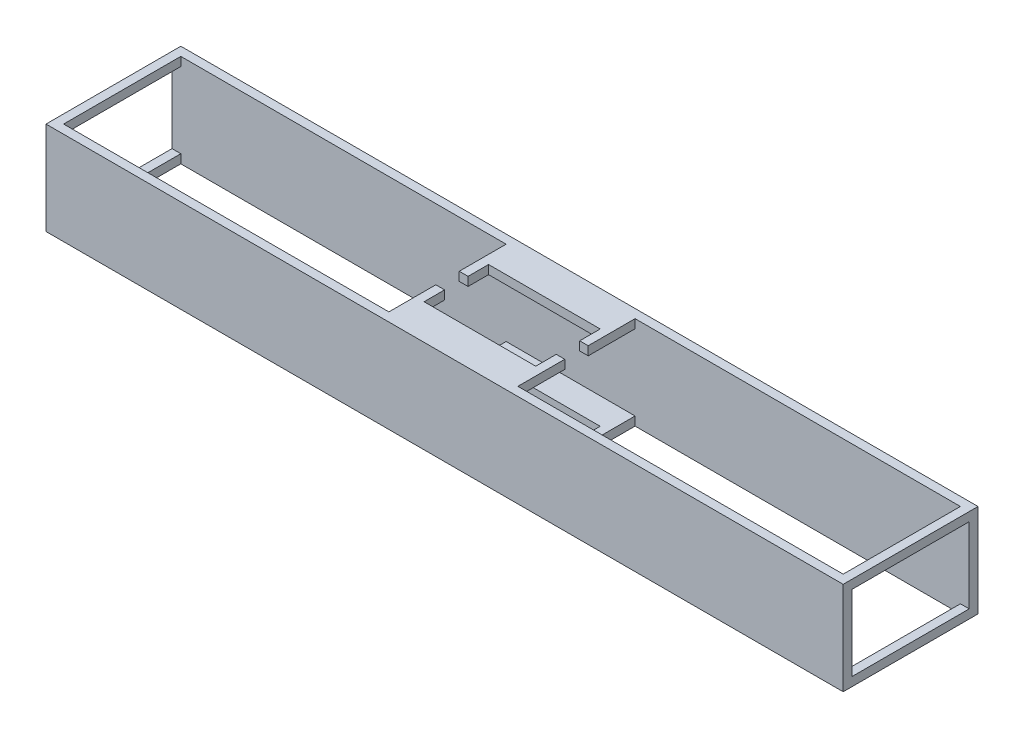
from build123d import *

# Parameters (mm, degrees)
SKETCH1_W           = 68
SKETCH1_H           = 11.5
BOSS_EXTRUDE1_DEPTH = 7.94
SKETCH2_W           = 27.75
SKETCH2_H           = 10
SKETCH2_W_2         = 9.525
SKETCH2_H_2         = 5.5
CUT_EXTRUDE1_DEPTH  = 36.385111276
SKETCH3_W           = 10
SKETCH3_H           = 6.44
CUT_EXTRUDE2_DEPTH  = 69.703028318
SKETCH4_W           = 11
SKETCH4_H           = 2
CUT_EXTRUDE3_DEPTH  = 2.5


with BuildPart() as part:
    # Sketch1 → Boss-Extrude1 (new body)
    with BuildSketch(Plane(origin=(0, 0, 0), x_dir=(1, 0, 0), z_dir=(0, 1, 0))):
        Rectangle(SKETCH1_W, SKETCH1_H)
    extrude(amount=BOSS_EXTRUDE1_DEPTH)

    # Sketch2 → Cut-Extrude1 (cut, through all)
    with BuildSketch(Plane(origin=(0, 7.94, 0), x_dir=(1, 0, 0), z_dir=(0, 1, 0))):
        with Locations((-19.375, 0)):
            Rectangle(SKETCH2_W, SKETCH2_H)
        with Locations((19.375, 0)):
            Rectangle(SKETCH2_W, SKETCH2_H)
        with Locations((0.0125, 0)):
            Rectangle(SKETCH2_W_2, SKETCH2_H_2)
    extrude(amount=-CUT_EXTRUDE1_DEPTH, mode=Mode.SUBTRACT)

    # Sketch3 → Cut-Extrude2 (cut, through all)
    with BuildSketch(Plane.ZY.offset(34)):
        with Locations((0, 3.97)):
            Rectangle(SKETCH3_W, SKETCH3_H)
    extrude(amount=-CUT_EXTRUDE2_DEPTH, mode=Mode.SUBTRACT)

    # Sketch4 → Cut-Extrude3 (cut)
    with BuildSketch(Plane(origin=(0, 7.94, 0), x_dir=(1, 0, 0), z_dir=(0, 1, 0))):
        Rectangle(SKETCH4_W, SKETCH4_H)
    extrude(amount=-CUT_EXTRUDE3_DEPTH, mode=Mode.SUBTRACT)


solid = part.part
